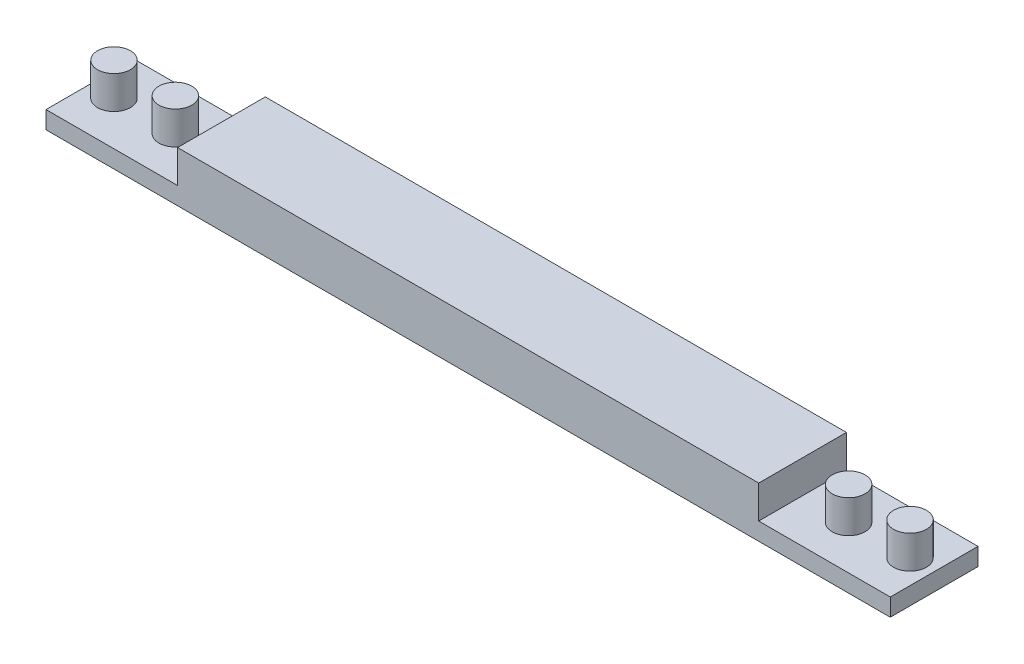
from build123d import *

# Parameters (mm, degrees)
SKETCH_1_W      = 26.5
SKETCH_1_H      = 4
SKETCH_1_W_2    = 6
EXTRUDE_1_DEPTH = 0.8
EXTRUDE_START   = 0.8
SKETCH_1_3_W    = 26.5
SKETCH_1_3_H    = 4
EXTRUDE_2_DEPTH = 1.5
SKETCH_2_R      = 0.75
EXTRUDE_3_DEPTH = 1.5


with BuildPart() as part:
    # Эскиз1 → Бобышка-Вытянуть1 (new body)
    with BuildSketch(Plane(origin=(0, 0, 0), x_dir=(1, 0, 0), z_dir=(0, 1, 0))):
        Rectangle(SKETCH_1_W, SKETCH_1_H)
        with Locations((-16.25, 0)):
            Rectangle(SKETCH_1_W_2, SKETCH_1_H)
        with Locations((16.25, 0)):
            Rectangle(SKETCH_1_W_2, SKETCH_1_H)
    extrude(amount=EXTRUDE_1_DEPTH)

    # Эскиз1<3> → Бобышка-Вытянуть2 (add)
    with BuildSketch(Plane(origin=(0, 0, 0), x_dir=(1, 0, 0), z_dir=(0, 1, 0)).offset(EXTRUDE_START)):
        Rectangle(SKETCH_1_3_W, SKETCH_1_3_H)
    extrude(amount=EXTRUDE_2_DEPTH)

    # Эскиз2 → Бобышка-Вытянуть3 (add)
    with BuildSketch(Plane(origin=(0, 0.8, 0), x_dir=(1, 0, 0), z_dir=(0, 1, 0))):
        with Locations(Location((-15.35, 0, 0), (0, 0, 270))):
            Circle(SKETCH_2_R)
        with Locations(Location((-18.15, 0, 0), (0, 0, 270))):
            Circle(SKETCH_2_R)
        with Locations(Location((18.15, 0, 0), (0, 0, 90))):
            Circle(SKETCH_2_R)
        with Locations(Location((15.35, 0, 0), (0, 0, 90))):
            Circle(SKETCH_2_R)
    extrude(amount=EXTRUDE_3_DEPTH)


solid = part.part
